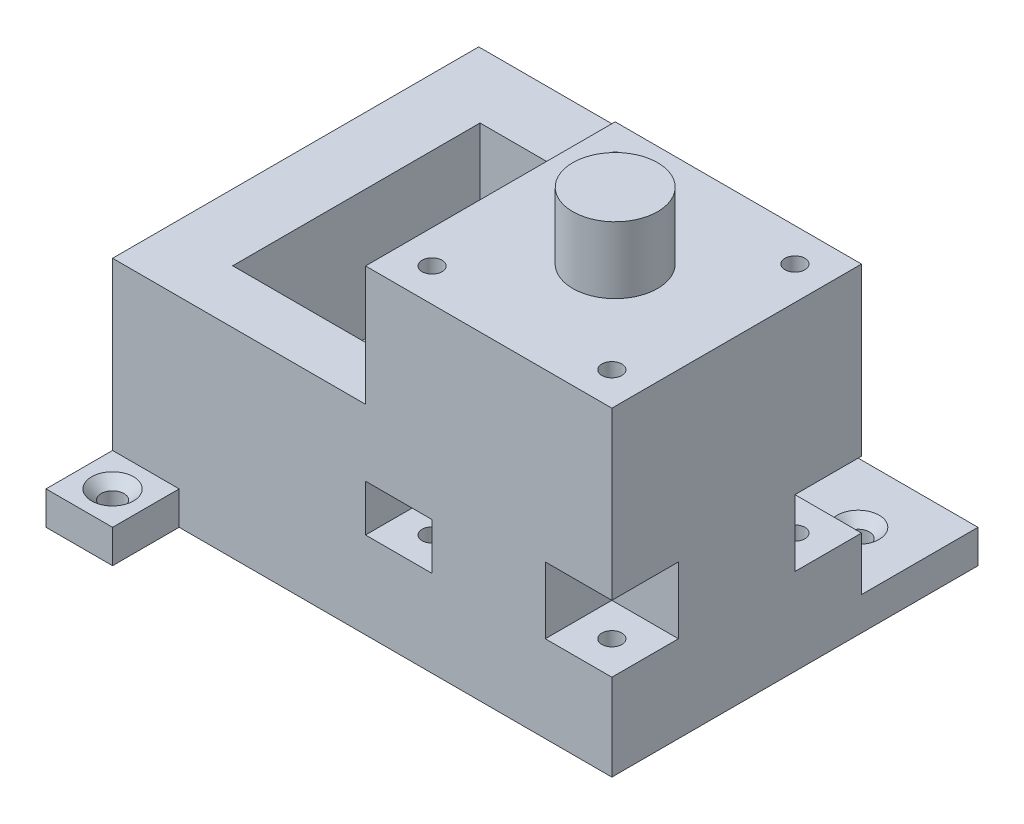
from build123d import *

# Parameters (mm, degrees)
BOSS_EXTRU_1_DEPTH                                = 30
ESQUISSE6_W                                       = 37
ESQUISSE6_H                                       = 37.5
BOSS_EXTRU_4_DEPTH                                = 18
ESQUISSE7_R                                       = 6.375
BOSS_EXTRU_5_DEPTH                                = 10
ESQUISSE8_R                                       = 1.5
ENL_V_MAT_EXTRU_1_DEPTH                           = 43
ESQUISSE9_W                                       = 10
ESQUISSE9_H                                       = 10
ENL_V_MAT_EXTRU_2_DEPTH                           = 10
ESQUISSE10_W                                      = 10
ESQUISSE10_H                                      = 7
ENL_V_MAT_EXTRU_5_DEPTH                           = 10
ESQUISSE11_W                                      = 10
ESQUISSE11_H                                      = 7
ENL_V_MAT_EXTRU_6_DEPTH                           = 10
ESQUISSE12_W                                      = 20
ESQUISSE12_H                                      = 37.154688963
ENL_V_MAT_EXTRU_7_DEPTH                           = 19.44
ESQUISSE13_W                                      = 10
ESQUISSE13_H                                      = 10
ENL_V_MAT_EXTRU_8_DEPTH                           = 9.801191536
ESQUISSE14_W                                      = 37
ESQUISSE14_H                                      = 17.5
BOSS_EXTRU_6_DEPTH                                = 5
ESQUISSE20_W                                      = 10
ESQUISSE20_H                                      = 5
BOSS_EXTRU_8_DEPTH                                = 10
FRAISAGE_POUR_VIS_T_TE_FRAIS_E_BOMB_E_D           = 3.4
FRAISAGE_POUR_VIS_T_TE_FRAIS_E_BOMB_E_DEPTH       = 5
FRAISAGE_POUR_VIS_T_TE_FRAIS_E_BOMB_E_CSINK_D     = 6.3
FRAISAGE_POUR_VIS_T_TE_FRAIS_E_BOMB_E_CSINK_ANGLE = 90
FRAISAGE_POUR_VIS_T_TE_FRAIS_E_BOMB_E_TIP         = 1.021463052


with BuildPart() as part:
    # Esquisse3 → Boss.-Extru.1 (new body)
    with BuildSketch(Plane(origin=(0, 0, 0), x_dir=(1, 0, 0), z_dir=(0, 1, 0))):
        Polygon((0, 0), (0, 55), (38, 55), (38, 37.5), (75, 37.5), (75, 0), align=None)
    extrude(amount=BOSS_EXTRU_1_DEPTH)

    # Esquisse6 → Boss.-Extru.4 (add)
    with BuildSketch(Plane(origin=(0, 30, 0), x_dir=(1, 0, 0), z_dir=(0, 1, 0))):
        with Locations((56.5, 18.75)):
            Rectangle(ESQUISSE6_W, ESQUISSE6_H)
    extrude(amount=BOSS_EXTRU_4_DEPTH)

    # Esquisse7 → Boss.-Extru.5 (add)
    with BuildSketch(Plane(origin=(0, 48, 0), x_dir=(1, 0, 0), z_dir=(0, 1, 0))):
        with Locations(Location((56.5, 19, 0), (0, 0, 270))):
            Circle(ESQUISSE7_R)
    extrude(amount=BOSS_EXTRU_5_DEPTH)

    # Esquisse8 → Enlèv. mat.-Extru.1 (cut)
    with BuildSketch(Plane(origin=(0, 48, 0), x_dir=(1, 0, 0), z_dir=(0, 1, 0))):
        with Locations(Location((43, 32.5, 0), (0, 0, 270))):
            Circle(ESQUISSE8_R)
        with Locations(Location((70, 32.5, 0), (0, 0, 270))):
            Circle(ESQUISSE8_R)
        with Locations(Location((70, 5, 0), (0, 0, 270))):
            Circle(ESQUISSE8_R)
        with Locations(Location((43, 5, 0), (0, 0, 270))):
            Circle(ESQUISSE8_R)
    extrude(amount=-ENL_V_MAT_EXTRU_1_DEPTH, mode=Mode.SUBTRACT)

    # Esquisse9 → Enlèv. mat.-Extru.2 (cut)
    with BuildSketch(Plane(origin=(75, 0, 0), x_dir=(0, 0, -1), z_dir=(1, 0, 0))):
        with Locations((5, 18)):
            Rectangle(ESQUISSE9_W, ESQUISSE9_H)
        with Locations((32.5, 18)):
            Rectangle(ESQUISSE9_W, ESQUISSE9_H)
    extrude(amount=-ENL_V_MAT_EXTRU_2_DEPTH, mode=Mode.SUBTRACT)

    # Esquisse10 → Enlèv. mat.-Extru.5 (cut)
    with BuildSketch(Plane(origin=(0, 0, -37.5), x_dir=(-1, 0, 0), z_dir=(0, 0, -1))):
        with Locations((-43, 16.5)):
            Rectangle(ESQUISSE10_W, ESQUISSE10_H)
    extrude(amount=-ENL_V_MAT_EXTRU_5_DEPTH, mode=Mode.SUBTRACT)

    # Esquisse11 → Enlèv. mat.-Extru.6 (cut)
    with BuildSketch(Plane.XY):
        with Locations((43, 16.5)):
            Rectangle(ESQUISSE11_W, ESQUISSE11_H)
    extrude(amount=-ENL_V_MAT_EXTRU_6_DEPTH, mode=Mode.SUBTRACT)

    # Esquisse12 → Enlèv. mat.-Extru.7 (cut)
    with BuildSketch(Plane(origin=(0, 30, 0), x_dir=(1, 0, 0), z_dir=(0, 1, 0))):
        with Locations((20, 26.621463983)):
            Rectangle(ESQUISSE12_W, ESQUISSE12_H)
    extrude(amount=-ENL_V_MAT_EXTRU_7_DEPTH, mode=Mode.SUBTRACT)

    # Esquisse13 → Enlèv. mat.-Extru.8 (cut)
    with BuildSketch(Plane.XY.offset(-45.198808464)):
        with Locations((20, 15.56)):
            Rectangle(ESQUISSE13_W, ESQUISSE13_H)
    extrude(amount=-ENL_V_MAT_EXTRU_8_DEPTH, mode=Mode.SUBTRACT)

    # Esquisse14 → Boss.-Extru.6 (add)
    with BuildSketch(Plane.XZ):
        with Locations((56.5, -46.25)):
            Rectangle(ESQUISSE14_W, ESQUISSE14_H)
    extrude(amount=-BOSS_EXTRU_6_DEPTH)

    # Esquisse20 → Boss.-Extru.8 (add)
    with BuildSketch(Plane.XY):
        with Locations((5, 2.5)):
            Rectangle(ESQUISSE20_W, ESQUISSE20_H)
    extrude(amount=BOSS_EXTRU_8_DEPTH)

    # Fraisage pour vis à tête fraisée bombée M32
    with Locations(Plane(origin=(0, 5, 0), x_dir=(1, 0, 0), z_dir=(0, 1, 0))):
        with Locations((5, -5), (47, 46), (66, 46)):
            CounterSinkHole(FRAISAGE_POUR_VIS_T_TE_FRAIS_E_BOMB_E_D / 2, FRAISAGE_POUR_VIS_T_TE_FRAIS_E_BOMB_E_CSINK_D / 2, depth=FRAISAGE_POUR_VIS_T_TE_FRAIS_E_BOMB_E_DEPTH, counter_sink_angle=FRAISAGE_POUR_VIS_T_TE_FRAIS_E_BOMB_E_CSINK_ANGLE)
            with Locations((0, 0, -(FRAISAGE_POUR_VIS_T_TE_FRAIS_E_BOMB_E_DEPTH + FRAISAGE_POUR_VIS_T_TE_FRAIS_E_BOMB_E_TIP / 2))):  # 118° drill point
                Cone(0, FRAISAGE_POUR_VIS_T_TE_FRAIS_E_BOMB_E_D / 2, FRAISAGE_POUR_VIS_T_TE_FRAIS_E_BOMB_E_TIP, mode=Mode.SUBTRACT)


solid = part.part
